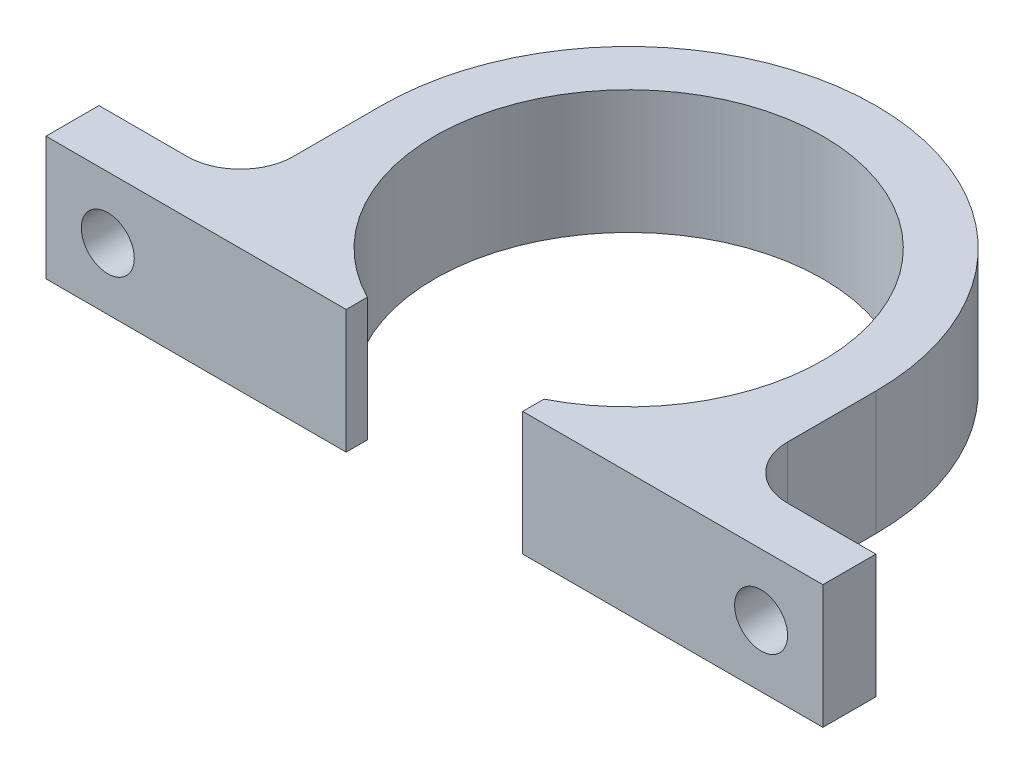
from build123d import *

# Parameters (mm, degrees)
SKETCH1_W           = 8
SKETCH1_H           = 3
BOSS_EXTRUDE2_DEPTH = 7
FILLET3_R           = 3
FILLET4_R           = 3
SKETCH3_R           = 1.5
CUT_EXTRUDE1_DEPTH  = 7


with BuildPart() as part:
    # Sketch1 → Boss-Extrude2 (new body)
    with BuildSketch(Plane(origin=(0, 0, 0), x_dir=(1, 0, 0), z_dir=(0, 1, 0))):
        with Locations((-18, -9.5)):
            Rectangle(SKETCH1_W, SKETCH1_H)
        with BuildLine():
            Line((-14, -8), (-11.489125293, -8))
            ThreePointArc((-11.489125293, -8), (-13.357540082, -4.192388692), (-14, 0))
            Line((-14, 0), (-14, -8))
        make_face()
        with BuildLine():
            Line((-14, -11), (-8.660254038, -11))
            ThreePointArc((-8.660254038, -11), (-10.185743559, -9.604719056), (-11.489125293, -8))
            Line((-11.489125293, -8), (-14, -8))
            Line((-14, -8), (-14, -11))
        make_face()
        with BuildLine():
            ThreePointArc((-11.489125293, -8), (-10.185743559, -9.604719056), (-8.660254038, -11))
            Line((-8.660254038, -11), (-5, -11))
            Line((-5, -11), (-5, -9.797958971))
            ThreePointArc((-5, -9.797958971), (-6.338986528, -8.989841478), (-7.549834435, -8))
            Line((-7.549834435, -8), (-11.489125293, -8))
        make_face()
        with BuildLine():
            ThreePointArc((-14, 0), (-13.357540082, -4.192388692), (-11.489125293, -8))
            Line((-11.489125293, -8), (-7.549834435, -8))
            ThreePointArc((-7.549834435, -8), (-10.100697471, -4.356134824), (-11, 0))
            Line((-11, 0), (-14, 0))
        make_face()
        with BuildLine():
            Line((11, 0), (14, 0))
            ThreePointArc((14, 0), (0, 14), (-14, 0))
            Line((-14, 0), (-11, 0))
            ThreePointArc((-11, 0), (0, 11), (11, 0))
        make_face()
        with BuildLine():
            Line((7.549834435, -8), (11.489125293, -8))
            ThreePointArc((11.489125293, -8), (13.357540082, -4.192388692), (14, 0))
            Line((14, 0), (11, 0))
            ThreePointArc((11, 0), (10.100697471, -4.356134824), (7.549834435, -8))
        make_face()
        with BuildLine():
            Line((5, -11), (8.660254038, -11))
            ThreePointArc((8.660254038, -11), (10.185743559, -9.604719056), (11.489125293, -8))
            Line((11.489125293, -8), (7.549834435, -8))
            ThreePointArc((7.549834435, -8), (6.338986528, -8.989841478), (5, -9.797958971))
            Line((5, -9.797958971), (5, -11))
        make_face()
        with BuildLine():
            Line((11.489125293, -8), (14, -8))
            Line((14, -8), (14, 0))
            ThreePointArc((14, 0), (13.357540082, -4.192388692), (11.489125293, -8))
        make_face()
        with BuildLine():
            Line((8.660254038, -11), (14, -11))
            Line((14, -11), (14, -8))
            Line((14, -8), (11.489125293, -8))
            ThreePointArc((11.489125293, -8), (10.185743559, -9.604719056), (8.660254038, -11))
        make_face()
        with Locations((18, -9.5)):
            Rectangle(SKETCH1_W, SKETCH1_H)
    extrude(amount=BOSS_EXTRUDE2_DEPTH)

    # Fillet3
    fillet3_edges = [part.edges().sort_by_distance(p)[0] for p in [
        (14, 3.5, 8),
    ]]
    fillet(fillet3_edges, radius=FILLET3_R)

    # Fillet4
    fillet4_edges = [part.edges().sort_by_distance(p)[0] for p in [
        (-14, 3.5, 8),
    ]]
    fillet(fillet4_edges, radius=FILLET4_R)

    # Sketch3 → Cut-Extrude1 (cut)
    with BuildSketch(Plane.XY.offset(11)):
        with Locations((-18.5, 3.5)):
            Circle(SKETCH3_R)
        with Locations((18.5, 3.5)):
            Circle(SKETCH3_R)
    extrude(amount=-CUT_EXTRUDE1_DEPTH, mode=Mode.SUBTRACT)


solid = part.part
